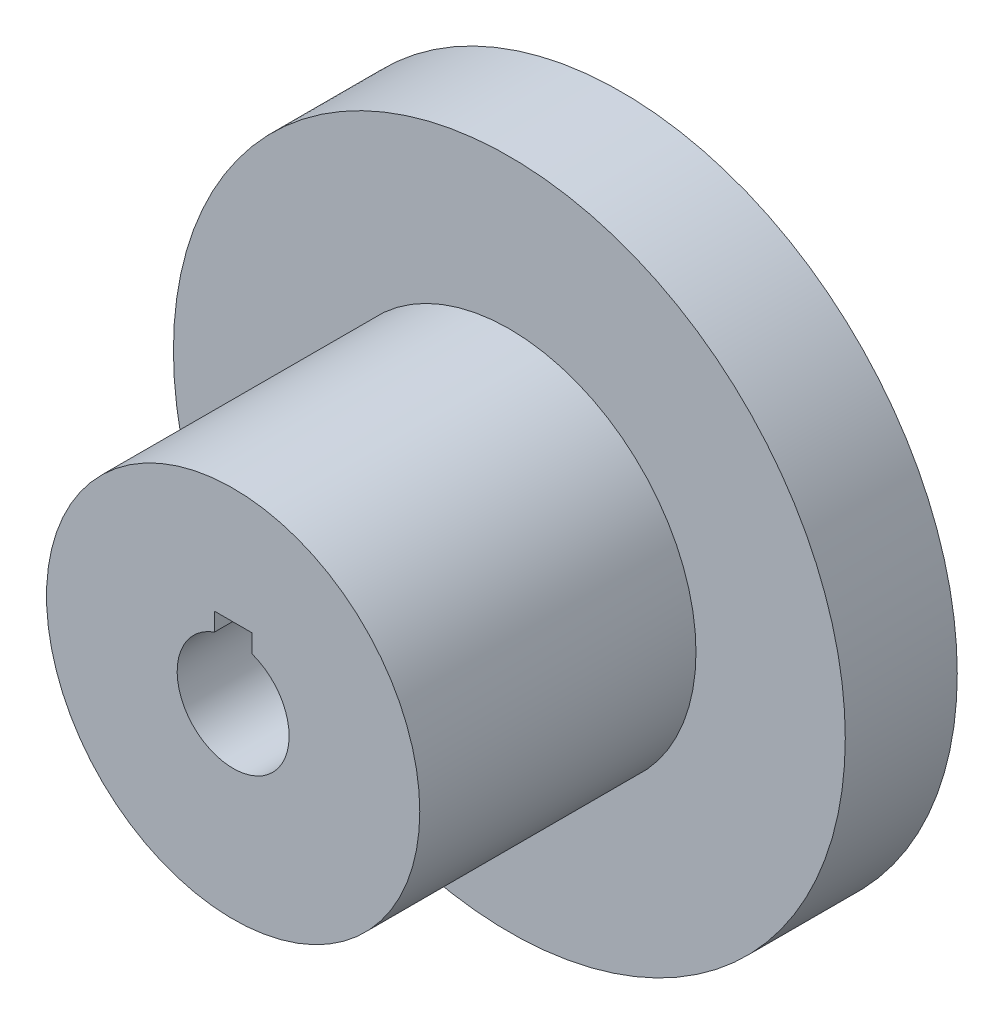
from build123d import *

# Parameters (mm, degrees)
SKETCH1_R           = 31.75
BASE_EXTRUDE_DEPTH  = 46.99
SKETCH2_R           = 57.15
BOSS_EXTRUDE1_DEPTH = 19.05
SKETCH4_R           = 47.625
CUT_EXTRUDE1_DEPTH  = 12.7
CUT_EXTRUDE2_DEPTH  = 105.372058521


with BuildPart() as part:
    # Sketch1 → Base-Extrude (new body)
    with BuildSketch(Plane.XY):
        Circle(SKETCH1_R)
    extrude(amount=-BASE_EXTRUDE_DEPTH)

    # Sketch2 → Boss-Extrude1 (add)
    with BuildSketch(Plane(origin=(0, 0, -46.99), x_dir=(-1, 0, 0), z_dir=(0, 0, -1))):
        Circle(SKETCH2_R)
    extrude(amount=BOSS_EXTRUDE1_DEPTH)

    # Sketch4 → Cut-Extrude1 (cut)
    with BuildSketch(Plane(origin=(0, 0, -66.04), x_dir=(-1, 0, 0), z_dir=(0, 0, -1))):
        Circle(SKETCH4_R)
    extrude(amount=-CUT_EXTRUDE1_DEPTH, mode=Mode.SUBTRACT)

    # Sketch6 → Cut-Extrude2 (cut, through all)
    with BuildSketch(Plane.XY):
        with BuildLine():
            Line((-3.175, 12.065), (3.175, 12.065))
            Line((3.175, 12.065), (3.175, 8.980256121))
            ThreePointArc((3.175, 8.980256121), (0, -9.525), (-3.175, 8.980256121))
            Line((-3.175, 8.980256121), (-3.175, 12.065))
        make_face()
    extrude(amount=-CUT_EXTRUDE2_DEPTH, mode=Mode.SUBTRACT)


solid = part.part
